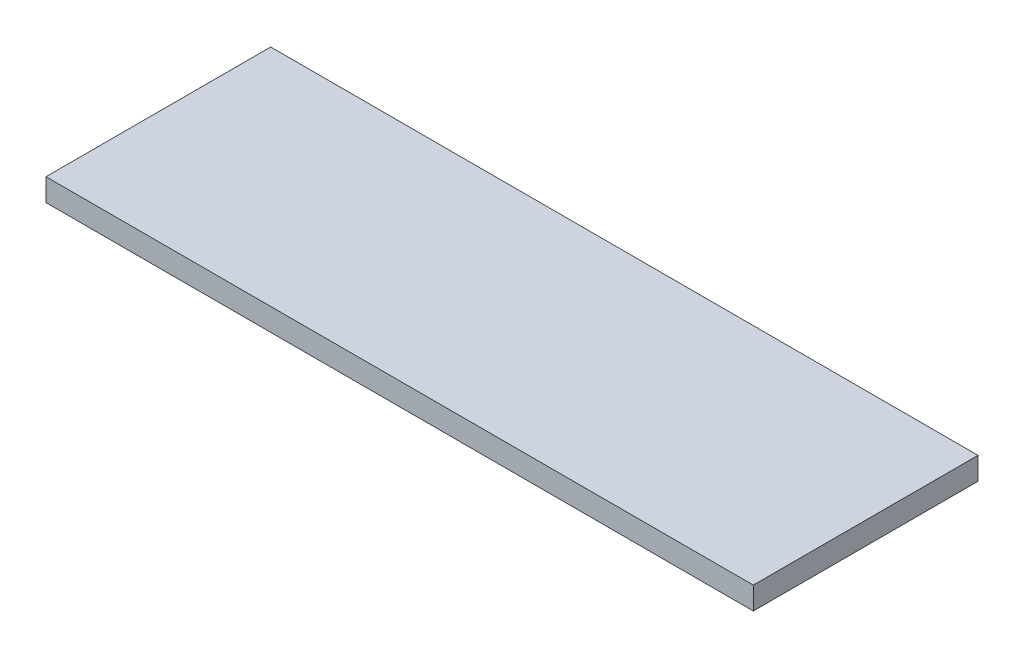
from build123d import *

# Parameters (mm, degrees)
SKETCH1_W           = 472.2
SKETCH1_H           = 150
BOSS_EXTRUDE1_DEPTH = 15


with BuildPart() as part:
    # Sketch1 → Boss-Extrude1 (new body)
    with BuildSketch(Plane(origin=(0, 0, 0), x_dir=(1, 0, 0), z_dir=(0, 1, 0))):
        Rectangle(SKETCH1_W, SKETCH1_H)
    extrude(amount=BOSS_EXTRUDE1_DEPTH)


solid = part.part
